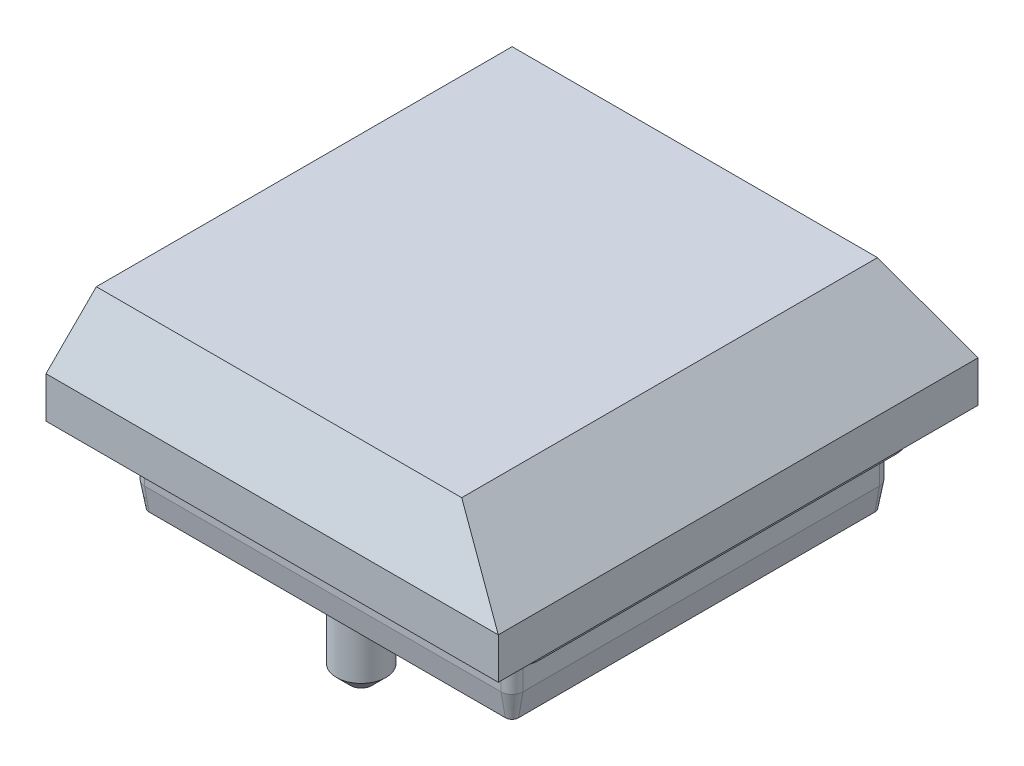
from build123d import *
from OCP.BRepFilletAPI import BRepFilletAPI_MakeChamfer

# Parameters (mm, degrees)
BOSS_EXTRUDE1_DEPTH = 0.8
BOSS_EXTRUDE2_DEPTH = 1.3
BOSS_EXTRUDE3_DEPTH = 0.9
BOSS_EXTRUDE3_TAPER = 10
SKETCH4_R           = 1.6
SKETCH4_R_2         = 0.9
BOSS_EXTRUDE4_DEPTH = 2.65
SKETCH5_R           = 0.6
BOSS_EXTRUDE5_DEPTH = 3
CHAMFER1_SIZE       = 0.5
CHAMFER1_SIZE2      = 0.419549816
CHAMFER2_SIZE       = 0.5
SKETCH6_W           = 16.5
SKETCH6_H           = 17.5
BOSS_EXTRUDE6_DEPTH = 4
CHAMFER3_SIZE       = 2.5
CHAMFER4_SIZE       = 2.5
CHAMFER4_SIZE2      = 1.165769145
CHAMFER5_SIZE       = 2.5
CHAMFER5_SIZE2      = 0.669872981


with BuildPart() as part:
    # Sketch1 → Boss-Extrude1 (new body)
    with BuildSketch(Plane(origin=(0, 0, 0), x_dir=(1, 0, 0), z_dir=(0, 1, 0))):
        with BuildLine():
            Line((-6.5, -7.5), (6.5, -7.5))
            ThreePointArc((6.5, -7.5), (7.207106781, -7.207106781), (7.5, -6.5))
            Line((7.5, -6.5), (7.5, 6.5))
            ThreePointArc((7.5, 6.5), (7.207106781, 7.207106781), (6.5, 7.5))
            Line((6.5, 7.5), (-6.5, 7.5))
            ThreePointArc((-6.5, 7.5), (-7.207106781, 7.207106781), (-7.5, 6.5))
            Line((-7.5, 6.5), (-7.5, -6.5))
            ThreePointArc((-7.5, -6.5), (-7.207106781, -7.207106781), (-6.5, -7.5))
        make_face()
    extrude(amount=BOSS_EXTRUDE1_DEPTH)

    # Sketch2 → Boss-Extrude2 (add)
    with BuildSketch(Plane.XZ):
        with BuildLine():
            Line((-6.9, 6.5), (-6.9, -6.5))
            ThreePointArc((-6.9, -6.5), (-6.782842712, -6.782842712), (-6.5, -6.9))
            Line((-6.5, -6.9), (6.5, -6.9))
            ThreePointArc((6.5, -6.9), (6.782842712, -6.782842712), (6.9, -6.5))
            Line((6.9, -6.5), (6.9, 6.5))
            ThreePointArc((6.9, 6.5), (6.782842712, 6.782842712), (6.5, 6.9))
            Line((6.5, 6.9), (-6.5, 6.9))
            ThreePointArc((-6.5, 6.9), (-6.782842712, 6.782842712), (-6.9, 6.5))
        make_face()
    extrude(amount=BOSS_EXTRUDE2_DEPTH)

    # Sketch3 → Boss-Extrude3 (add)
    with BuildSketch(Plane.XZ.offset(1.3)):
        with BuildLine():
            Line((-6.9, 6.5), (-6.9, -6.5))
            ThreePointArc((-6.9, -6.5), (-6.782842712, -6.782842712), (-6.5, -6.9))
            Line((-6.5, -6.9), (6.5, -6.9))
            ThreePointArc((6.5, -6.9), (6.782842712, -6.782842712), (6.9, -6.5))
            Line((6.9, -6.5), (6.9, 6.5))
            ThreePointArc((6.9, 6.5), (6.782842712, 6.782842712), (6.5, 6.9))
            Line((6.5, 6.9), (-6.5, 6.9))
            ThreePointArc((-6.5, 6.9), (-6.782842712, 6.782842712), (-6.9, 6.5))
        make_face()
    extrude(amount=BOSS_EXTRUDE3_DEPTH, taper=BOSS_EXTRUDE3_TAPER)

    # Sketch4 → Boss-Extrude4 (add)
    with BuildSketch(Plane.XZ.offset(2.2)):
        with Locations(Location((0, 0, 0), (0, 0, 270))):
            Circle(SKETCH4_R)
        with Locations(Location((0, -5.5, 0), (0, 0, 270))):
            Circle(SKETCH4_R_2)
        with Locations(Location((0, 5.5, 0), (0, 0, 90))):
            Circle(SKETCH4_R_2)
    extrude(amount=BOSS_EXTRUDE4_DEPTH)

    # Sketch5 → Boss-Extrude5 (add)
    with BuildSketch(Plane.XZ.offset(2.2)):
        with Locations(Location((-5.9, 0, 0), (0, 0, 270))):
            Circle(SKETCH5_R)
        with Locations(Location((-3.8, -5, 0), (0, 0, 270))):
            Circle(SKETCH5_R)
    extrude(amount=BOSS_EXTRUDE5_DEPTH)

    # Chamfer1: one chamfer whose edges measure the first distance from different faces: ONE call of the kernel's chamfer builder (chamfer() names one face for all edges)
    chamfer1_edges_1 = [part.edges().sort_by_distance(p)[0] for p in [
        (-5.9, -5.2, 0.6),
    ]]
    chamfer1_side_1 = [part.faces().sort_by_distance(p)[0] for p in [
        (-5.9, -3.7, 0.6),
    ]]
    chamfer1_edges_2 = [part.edges().sort_by_distance(p)[0] for p in [
        (-3.8, -5.2, -4.4),
    ]]
    chamfer1_side_2 = [part.faces().sort_by_distance(p)[0] for p in [
        (-3.8, -3.7, -4.4),
    ]]
    chamfer1 = BRepFilletAPI_MakeChamfer(part.part.solid().wrapped)
    for e in chamfer1_edges_1:
        chamfer1.Add(CHAMFER1_SIZE, CHAMFER1_SIZE2, e.wrapped, chamfer1_side_1[0].wrapped)  # the first distance lies on this face
    for e in chamfer1_edges_2:
        chamfer1.Add(CHAMFER1_SIZE, CHAMFER1_SIZE2, e.wrapped, chamfer1_side_2[0].wrapped)  # the first distance lies on this face
    add(Compound.cast(chamfer1.Shape()), mode=Mode.REPLACE)

    # Chamfer2
    chamfer2_edges = [part.edges().sort_by_distance(p)[0] for p in [
        (0, -4.85, 1.6),
        (0, -4.85, -4.6),
        (0, -4.85, 4.6),
    ]]
    chamfer(chamfer2_edges, length=CHAMFER2_SIZE)

    # Sketch6 → Boss-Extrude6 (add)
    with BuildSketch(Plane(origin=(0, 0.8, 0), x_dir=(1, 0, 0), z_dir=(0, 1, 0))):
        Rectangle(SKETCH6_W, SKETCH6_H)
    extrude(amount=BOSS_EXTRUDE6_DEPTH)

    # Chamfer3
    chamfer3_edges = [part.edges().sort_by_distance(p)[0] for p in [
        (8.25, 4.8, 0),
    ]]
    chamfer(chamfer3_edges, length=CHAMFER3_SIZE)

    # Chamfer4: one chamfer whose edges measure the first distance from different faces: ONE call of the kernel's chamfer builder (chamfer() names one face for all edges)
    chamfer4_edges_1 = [part.edges().sort_by_distance(p)[0] for p in [
        (-1.25, 4.8, -8.75),
    ]]
    chamfer4_side_1 = [part.faces().sort_by_distance(p)[0] for p in [
        (-0.368621604, 2.742014579, -8.75),
    ]]
    chamfer4_edges_2 = [part.edges().sort_by_distance(p)[0] for p in [
        (-1.25, 4.8, 8.75),
    ]]
    chamfer4_side_2 = [part.faces().sort_by_distance(p)[0] for p in [
        (-0.368621604, 2.742014579, 8.75),
    ]]
    chamfer4 = BRepFilletAPI_MakeChamfer(part.part.solid().wrapped)
    for e in chamfer4_edges_1:
        chamfer4.Add(CHAMFER4_SIZE, CHAMFER4_SIZE2, e.wrapped, chamfer4_side_1[0].wrapped)  # the first distance lies on this face
    for e in chamfer4_edges_2:
        chamfer4.Add(CHAMFER4_SIZE, CHAMFER4_SIZE2, e.wrapped, chamfer4_side_2[0].wrapped)  # the first distance lies on this face
    add(Compound.cast(chamfer4.Shape()), mode=Mode.REPLACE)

    # Chamfer5
    chamfer5_edges = [part.edges().sort_by_distance(p)[0] for p in [
        (-8.25, 4.8, 0),
    ]]
    chamfer5_side = [part.faces().sort_by_distance(p)[0] for p in [
        (-8.25, 2.74931608, 0),
    ]]
    chamfer(chamfer5_edges, length=CHAMFER5_SIZE, length2=CHAMFER5_SIZE2, reference=chamfer5_side[0])


solid = part.part
